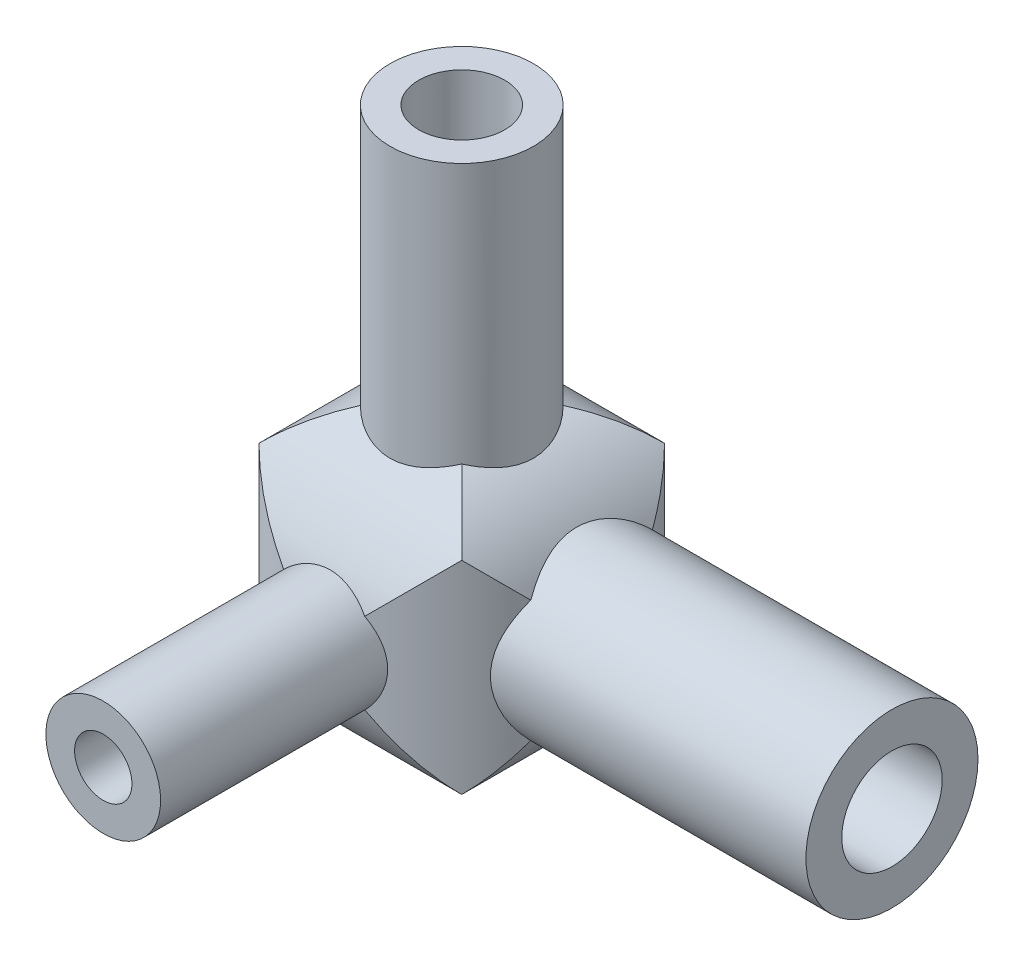
from build123d import *

# Parameters (mm, degrees)
SWEEP_2_PROFILE_R   = 20
SKETCH_2_W          = 120
SKETCH_2_H          = 120
SKETCH_2_R          = 20
CUT_EXTRUDE_1_DEPTH = 49.989794856
SKETCH_3_W          = 120
SKETCH_3_H          = 120
SKETCH_3_R          = 20
CUT_EXTRUDE_2_DEPTH = 49.989794856
SWEEP_4_PROFILE_R   = 12
SWEEP_6_PROFILE_R   = 10
SWEEP_8_PROFILE_R   = 8
SWEEP_10_PROFILE_R  = 6
SKETCH_9_R          = 7
CUT_EXTRUDE_3_DEPTH = 65
SKETCH_10_R         = 6
CUT_EXTRUDE_4_DEPTH = 60
SKETCH_11_R         = 4
CUT_EXTRUDE_5_DEPTH = 55


with BuildPart() as part:
    # 扫描2: sweep along a curve in space
    with BuildLine() as sweep_2_path:
        Line((-20, 0, 0), (20, 0, 0))
    # 扫描2 profile (on start of the path) → 扫描2 (sweep)
    with BuildSketch(Plane(origin=(-20, 0, 0), x_dir=(0, 0, 1), z_dir=(1, 0, 0))):
        Circle(SWEEP_2_PROFILE_R)
    sweep(path=sweep_2_path.line)

    # 草图2 → 切除-拉伸1 (cut, through all)
    with BuildSketch(Plane(origin=(0, -20, 0), x_dir=(1, 0, 0), z_dir=(0, 1, 0))):
        Rectangle(SKETCH_2_W, SKETCH_2_H)
        Circle(SKETCH_2_R, mode=Mode.SUBTRACT)
    extrude(amount=CUT_EXTRUDE_1_DEPTH, mode=Mode.SUBTRACT)

    # 草图3 → 切除-拉伸2 (cut, through all)
    with BuildSketch(Plane.XY.offset(-20)):
        Rectangle(SKETCH_3_W, SKETCH_3_H)
        Circle(SKETCH_3_R, mode=Mode.SUBTRACT)
    extrude(amount=CUT_EXTRUDE_2_DEPTH, mode=Mode.SUBTRACT)

    # 扫描4: sweep along a curve in space
    with BuildLine() as sweep_4_path:
        Line((-5, 0, 0), (60, 0, 0))
    # 扫描4 profile (on start of the path) → 扫描4 (sweep)
    with BuildSketch(Plane(origin=(-5, 0, 0), x_dir=(0, 0, 1), z_dir=(1, 0, 0))):
        Circle(SWEEP_4_PROFILE_R)
    sweep(path=sweep_4_path.line)

    # 扫描6: sweep along a curve in space
    with BuildLine() as sweep_6_path:
        Line((0, -5, 0), (0, 55, 0))
    # 扫描6 profile (on start of the path) → 扫描6 (sweep)
    with BuildSketch(Plane.ZX.offset(-5)):
        Circle(SWEEP_6_PROFILE_R)
    sweep(path=sweep_6_path.line)

    # 扫描8: sweep along a curve in space
    with BuildLine() as sweep_8_path:
        Line((0, 0, -5), (0, 0, 50))
    # 扫描8 profile (on start of the path) → 扫描8 (sweep)
    with BuildSketch(Plane.XY.offset(-5)):
        Circle(SWEEP_8_PROFILE_R)
    sweep(path=sweep_8_path.line)

    # 扫描10: sweep along a curve in space
    with BuildLine() as sweep_10_path:
        Line((2.886751, 2.886751, 2.886751), (-28.867513, -28.867513, -28.867513))
    # 扫描10 profile (on start of the path) → 扫描10 (sweep)
    with BuildSketch(Plane(origin=(2.886751, 2.886751, 2.886751), x_dir=(-0.7071067811865476, 0, 0.7071067811865476), z_dir=(-0.5773502691896257, -0.5773502691896257, -0.5773502691896257))):
        Circle(SWEEP_10_PROFILE_R)
    sweep(path=sweep_10_path.line)

    # 草图8 → 旋转1 (revolve)
    with BuildSketch(Plane.XY.offset(-28.867513)):
        with BuildLine():
            Line((-33.110154, -33.110154), (-24.624872, -24.624872))
            ThreePointArc((-24.624872, -24.624872), (-24.624872, -33.110154), (-33.110154, -33.110154))
        make_face()
    revolve(axis=Axis((-33.110154, -33.110154, -28.867513), (0.7071067811865476, 0.7071067811865476, 0)))

    # 草图9 → 切除-拉伸3 (cut)
    with BuildSketch(Plane(origin=(60, 0, 0), x_dir=(0, 0, -1), z_dir=(1, 0, 0))):
        Circle(SKETCH_9_R)
    extrude(amount=-CUT_EXTRUDE_3_DEPTH, mode=Mode.SUBTRACT)

    # 草图10 → 切除-拉伸4 (cut)
    with BuildSketch(Plane(origin=(0, 55, 0), x_dir=(1, 0, 0), z_dir=(0, 1, 0))):
        with Locations(Location((0, 0, 0), (0, 0, 270))):
            Circle(SKETCH_10_R)
    extrude(amount=-CUT_EXTRUDE_4_DEPTH, mode=Mode.SUBTRACT)

    # 草图11 → 切除-拉伸5 (cut)
    with BuildSketch(Plane.XY.offset(50)):
        Circle(SKETCH_11_R)
    extrude(amount=-CUT_EXTRUDE_5_DEPTH, mode=Mode.SUBTRACT)


solid = part.part
